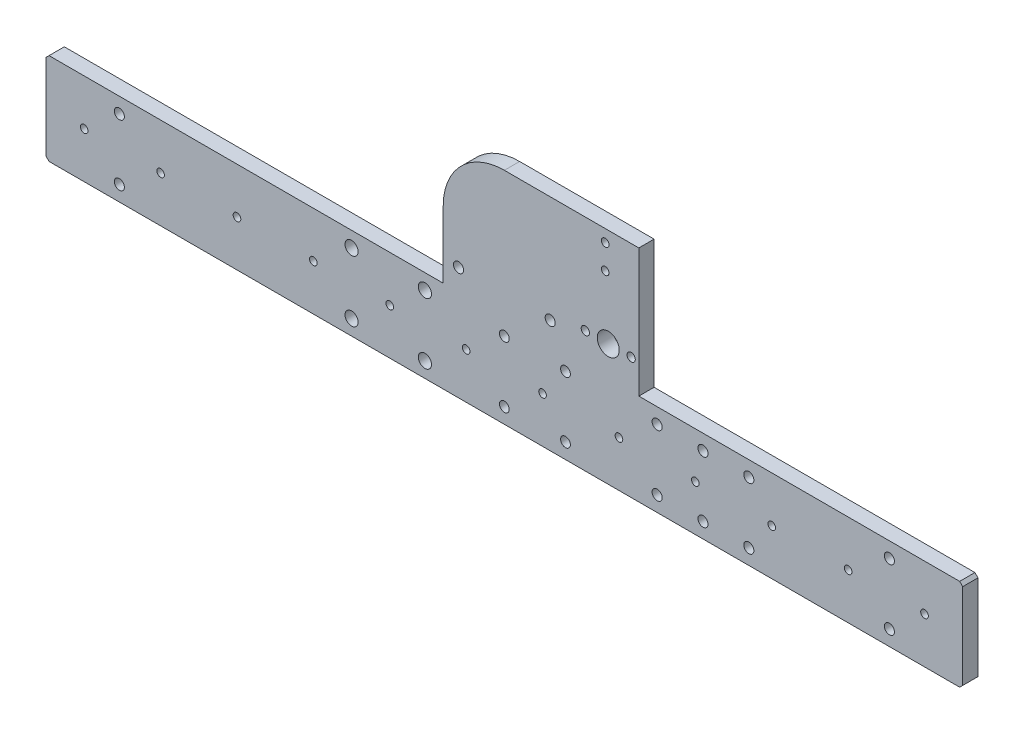
from build123d import *

# Parameters (mm, degrees)
SKETCH_1_W                 = 300
SKETCH_1_H                 = 30
EXTRUDE_1_DEPTH            = 5
CHAMFER_1_SIZE             = 1
HOLE_WIZARD_M3_1_D         = 3.2
M3X0_5_1_D                 = 2.5
M4X0_7_1_D                 = 3.3
M4X0_7_2_D                 = 3.3
PATTERN_LINEAR_1_COUNT     = 6
PATTERN_LINEAR_1_PITCH     = 25
PATTERN_LINEAR_1_COL_COUNT = 7
PATTERN_LINEAR_1_COL_PITCH = 25
EXTRUDE_3_DEPTH            = 5
SKETCH_13_R                = 3.6
CUT_EXTRUDE_2_DEPTH        = 161.542829177
HOLE_WIZARD_M2_5_1_D       = 2.7
M4X0_7_3_D                 = 3.3
HOLE_WIZARD_M4_1_D         = 4.3
M3X0_5_2_D                 = 2.5


with BuildPart() as part:
    # 草圖1 → 填料-伸長1 (new body)
    with BuildSketch(Plane.XY):
        Rectangle(SKETCH_1_W, SKETCH_1_H)
    extrude(amount=EXTRUDE_1_DEPTH)

    # 導角1
    chamfer_1_edges = [part.edges().sort_by_distance(p)[0] for p in [
        (150, -15, 2.5),
        (-150, -15, 2.5),
        (-150, 15, 2.5),
        (150, 15, 2.5),
    ]]
    chamfer(chamfer_1_edges, length=CHAMFER_1_SIZE)

    # M3 餘隙孔1 (through all)
    with Locations(Plane.XY.offset(5)):
        with Locations((20, -10), (20, 10), (0, -10), (0, 10)):
            Hole(HOLE_WIZARD_M3_1_D / 2)

    # M3x0.5 螺紋孔1 (through all)
    with Locations(Plane.XY.offset(5)):
        with Locations((-12.5, 0)):
            m3x0_5_1 = Hole(M3X0_5_1_D / 2)

    # M4x0.7 螺紋孔1 (through all)
    with Locations(Plane.XY.offset(5)):
        with Locations((80, 10), (50, -10), (50, 10), (80, -10), (65, 10), (65, -10)):
            Hole(M4X0_7_1_D / 2)

    # M4x0.7 螺紋孔2 (through all)
    with Locations(Plane.XY.offset(5)):
        with Locations((-126, 10), (-126, -10)):
            m4x0_7_2 = Hole(M4X0_7_2_D / 2)

    # 直線複製排列1: M3x0.5 螺紋孔1 ×6
    with Locations(*[(-i * PATTERN_LINEAR_1_PITCH, 0, 0) for i in range(1, PATTERN_LINEAR_1_COUNT)]):
        add(m3x0_5_1, mode=Mode.SUBTRACT)

    # 直線複製排列1 col: M3x0.5 螺紋孔1 ×7
    with Locations(*[(i * PATTERN_LINEAR_1_COL_PITCH, 0, 0) for i in range(1, PATTERN_LINEAR_1_COL_COUNT)]):
        add(m3x0_5_1, mode=Mode.SUBTRACT)

    # 鏡射1: M4x0.7 螺紋孔2 across plane
    add(m4x0_7_2.mirror(Plane(origin=(0, 0, 0), x_dir=(0, 0, 1), z_dir=(1, 0, 0))), mode=Mode.SUBTRACT)

    # 草圖16 → 填料-伸長3 (add, through all)
    with BuildSketch(Plane.XY):
        with BuildLine():
            Line((-20, 15), (44, 15))
            Line((44, 15), (44, 57))
            Line((44, 57), (0, 57))
            ThreePointArc((0, 57), (-14.142135624, 51.142135624), (-20, 37))
            Line((-20, 37), (-20, 15))
        make_face()
    extrude(amount=EXTRUDE_3_DEPTH)

    # 草圖13 → 除料-伸長2 (cut, through all)
    with BuildSketch(Plane.XY):
        with Locations(Location((34, 24.8, 0), (0, 0, 180))):
            Circle(SKETCH_13_R)
    extrude(amount=CUT_EXTRUDE_2_DEPTH, mode=Mode.SUBTRACT)

    # M2.5 餘隙孔1 (through all)
    with Locations(Plane.XY.offset(5)):
        with Locations((26.5, 24.8), (41.5, 24.8)):
            Hole(HOLE_WIZARD_M2_5_1_D / 2)

    # M4x0.7 螺紋孔3 (through all)
    with Locations(Plane.XY.offset(5)):
        with Locations((15, 22), (-15, 22)):
            Hole(M4X0_7_3_D / 2)

    # M4 餘隙孔1 (through all)
    with Locations(Plane.XY.offset(5)):
        with Locations((-26, -10), (-26, 10), (-50, -10), (-50, 10)):
            Hole(HOLE_WIZARD_M4_1_D / 2)

    # M3x0.5 螺紋孔2 (through all)
    with Locations(Plane.XY.offset(5)):
        with Locations((33, 53), (33, 45)):
            Hole(M3X0_5_2_D / 2)


solid = part.part
